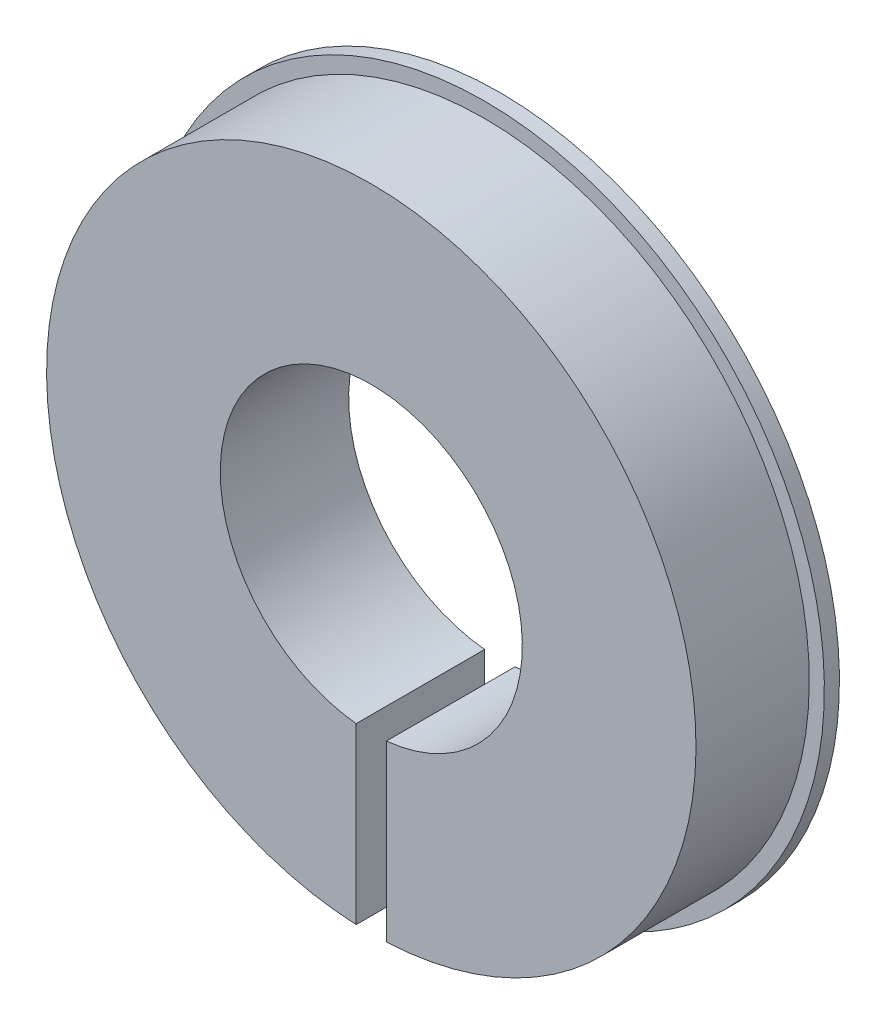
from build123d import *

# Parameters (mm, degrees)
SZKIC2_R                    = 22.5
DODANIE_WYCI_GNI_CIE1_DEPTH = 1
SZKIC3_R                    = 21.5
DODANIE_WYCI_GNI_CIE2_DEPTH = 7.5
WYTNIJ_WYCI_GNI_CIE1_DEPTH  = 10


with BuildPart() as part:
    # Szkic2 → Dodanie-wyciągnięcie1 (new body)
    with BuildSketch(Plane.XY):
        Circle(SZKIC2_R)
    extrude(amount=DODANIE_WYCI_GNI_CIE1_DEPTH)

    # Szkic3 → Dodanie-wyciągnięcie2 (add)
    with BuildSketch(Plane.XY.offset(1)):
        Circle(SZKIC3_R)
    extrude(amount=DODANIE_WYCI_GNI_CIE2_DEPTH)

    # Szkic4 → Wytnij-wyciągnięcie1 (cut)
    with BuildSketch(Plane.XY.offset(8.5)):
        with BuildLine():
            Line((-1, -9.949874371), (-1, -23.658625842))
            Line((-1, -23.658625842), (1, -23.658625842))
            Line((1, -23.658625842), (1, -9.949874371))
            ThreePointArc((1, -9.949874371), (0, 10), (-1, -9.949874371))
        make_face()
    extrude(amount=-WYTNIJ_WYCI_GNI_CIE1_DEPTH, mode=Mode.SUBTRACT)


solid = part.part
